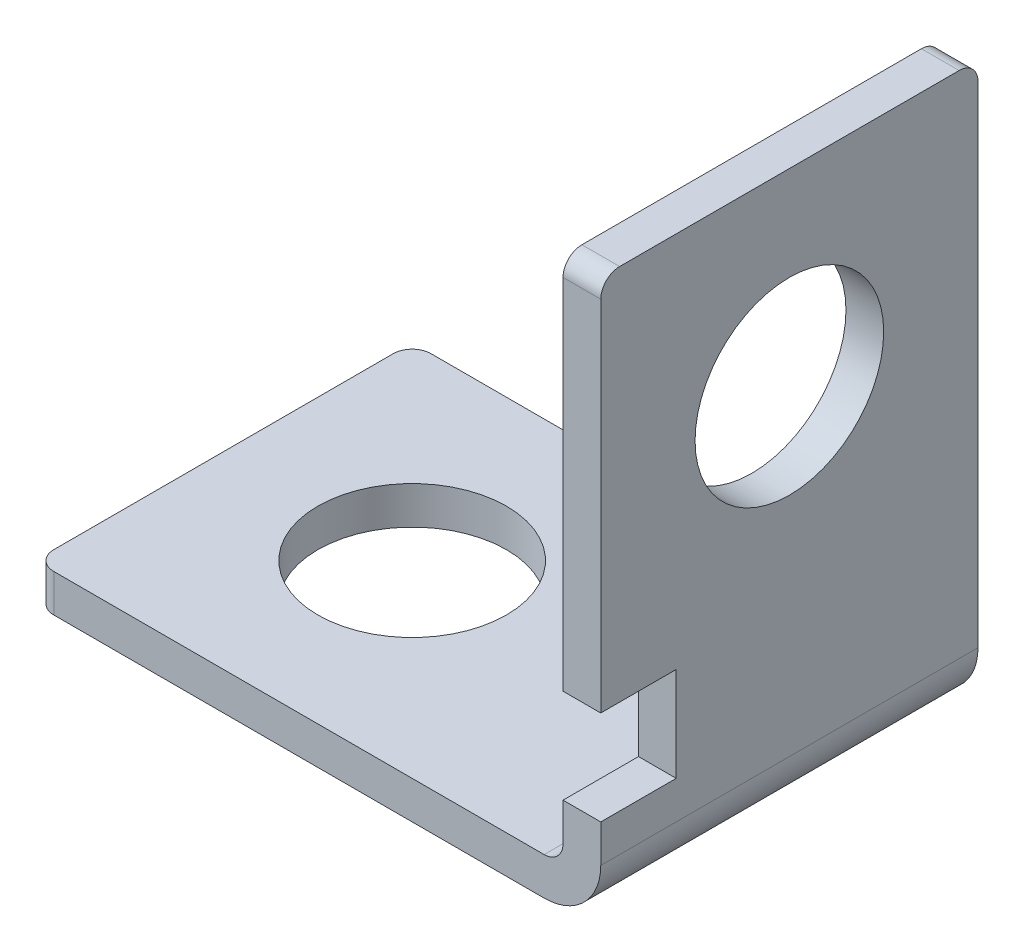
from build123d import *

# Parameters (mm, degrees)
BOSS_EXTRUDE1_DEPTH = 20
FILLET1_R           = 1
SKETCH3_R           = 5
SKETCH3_W           = 4
SKETCH3_H           = 5
CUT_EXTRUDE1_DEPTH  = 46.650848842
SKETCH4_R           = 5
CUT_EXTRUDE2_DEPTH  = 46.650848842


with BuildPart() as part:
    # Sketch2 → Boss-Extrude1 (new body)
    with BuildSketch(Plane.XY):
        with BuildLine():
            Line((0, 0), (27, 0))
            ThreePointArc((27, 0), (29.121320344, 0.878679656), (30, 3))
            Line((30, 3), (30, 30))
            Line((30, 30), (28, 30))
            Line((28, 30), (28, 3))
            ThreePointArc((28, 3), (27.707106781, 2.292893219), (27, 2))
            Line((27, 2), (0, 2))
            Line((0, 2), (0, 0))
        make_face()
    extrude(amount=BOSS_EXTRUDE1_DEPTH)

    # Fillet1
    fillet1_edges = [part.edges().sort_by_distance(p)[0] for p in [
        (0, 1, 0),
        (29, 30, 20),
        (0, 1, 20),
        (29, 30, 0),
    ]]
    fillet(fillet1_edges, radius=FILLET1_R)

    # Sketch3 → Cut-Extrude1 (cut, through all)
    with BuildSketch(Plane.ZY.offset(-28)):
        with Locations(Location((10, 20, 0), (0, 0, 270))):
            Circle(SKETCH3_R)
        with Locations((18, 7.5)):
            Rectangle(SKETCH3_W, SKETCH3_H)
    extrude(amount=-CUT_EXTRUDE1_DEPTH, mode=Mode.SUBTRACT)

    # Sketch4 → Cut-Extrude2 (cut, through all)
    with BuildSketch(Plane(origin=(0, 2, 0), x_dir=(1, 0, 0), z_dir=(0, 1, 0))):
        with Locations(Location((10, -10, 0), (0, 0, 270))):
            Circle(SKETCH4_R)
    extrude(amount=-CUT_EXTRUDE2_DEPTH, mode=Mode.SUBTRACT)


solid = part.part
